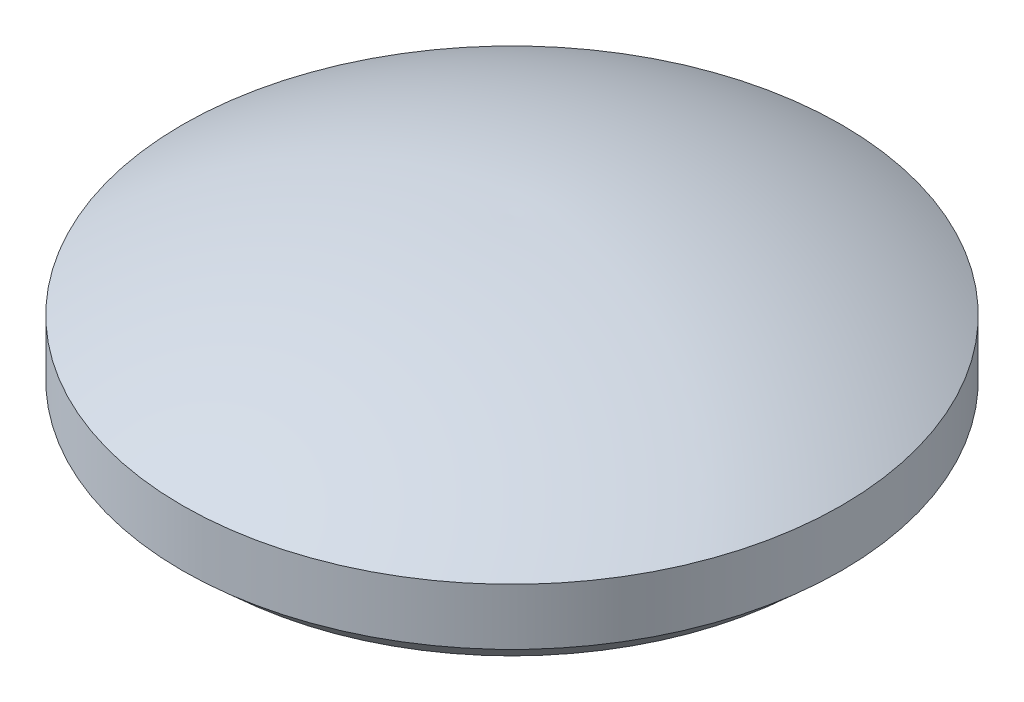
from build123d import *


with BuildPart() as part:
    # Sketch1 → Revolve1 (revolve)
    with BuildSketch(Plane.XY, mode=Mode.PRIVATE) as revolve1_sk:
        with BuildLine():
            Line((0, 0), (0, 65))
            ThreePointArc((0, 65), (39.390756487, 60.284874652), (76, 45))
            Line((76, 45), (76, 32))
            Line((76, 32), (69.34375, 26))
            Line((69.34375, 26), (51.34375, 26))
            Line((51.34375, 26), (22.5, 0))
            Line((22.5, 0), (0, 0))
        make_face()
    revolve(revolve1_sk.sketch.rotate(Axis((0, 0, 0), (0, 1, 0)), 90), axis=Axis((0, 0, 0), (0, 1, 0)))


solid = part.part
